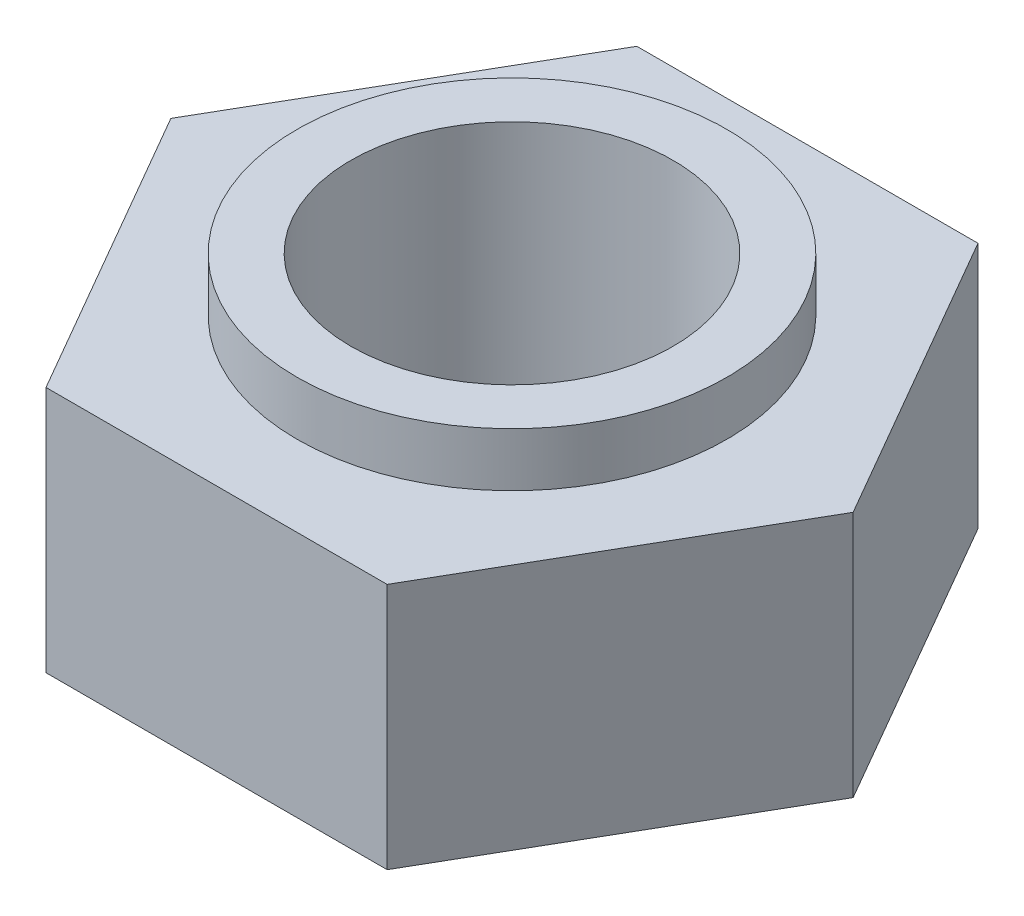
from build123d import *

# Parameters (mm, degrees)
SKETCH1_R           = 1.5
BOSS_EXTRUDE1_DEPTH = 2.3
SKETCH2_R           = 2
SKETCH2_R_2         = 1.5
BOSS_EXTRUDE2_DEPTH = 0.5


with BuildPart() as part:
    # Sketch1 → Boss-Extrude1 (new body)
    with BuildSketch(Plane(origin=(0, 0, 0), x_dir=(1, 0, 0), z_dir=(0, 1, 0))):
        Polygon((3.175426481, 0), (1.58771324, 2.75), (-1.58771324, 2.75), (-3.175426481, 0), (-1.58771324, -2.75), (1.58771324, -2.75), align=None)
        with Locations(Location((0, 0, 0), (0, 0, 270))):
            Circle(SKETCH1_R, mode=Mode.SUBTRACT)
    extrude(amount=BOSS_EXTRUDE1_DEPTH)

    # Sketch2 → Boss-Extrude2 (add)
    with BuildSketch(Plane(origin=(0, 2.3, 0), x_dir=(1, 0, 0), z_dir=(0, 1, 0))):
        with Locations(Location((0, 0, 0), (0, 0, 270))):
            Circle(SKETCH2_R)
        with Locations(Location((0, 0, 0), (0, 0, 270))):
            Circle(SKETCH2_R_2, mode=Mode.SUBTRACT)
    extrude(amount=BOSS_EXTRUDE2_DEPTH)


solid = part.part
